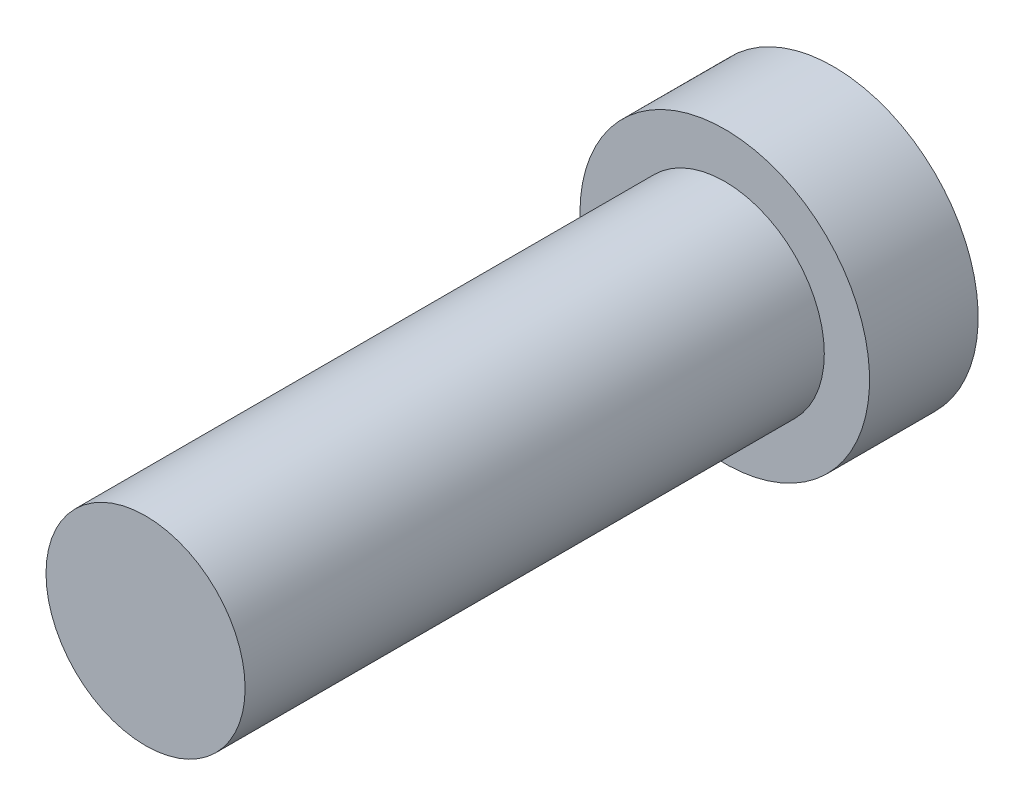
from build123d import *

# Parameters (mm, degrees)
SKETCH2_R           = 1.375
BOSS_EXTRUDE1_DEPTH = 8
SKETCH3_R           = 2
BOSS_EXTRUDE2_DEPTH = 1.5


with BuildPart() as part:
    # Sketch2 → Boss-Extrude1 (new body)
    with BuildSketch(Plane.XY):
        Circle(SKETCH2_R)
    extrude(amount=BOSS_EXTRUDE1_DEPTH)

    # Sketch3 → Boss-Extrude2 (add)
    with BuildSketch(Plane(origin=(0, 0, 0), x_dir=(-1, 0, 0), z_dir=(0, 0, -1))):
        Circle(SKETCH3_R)
    extrude(amount=BOSS_EXTRUDE2_DEPTH)


solid = part.part
